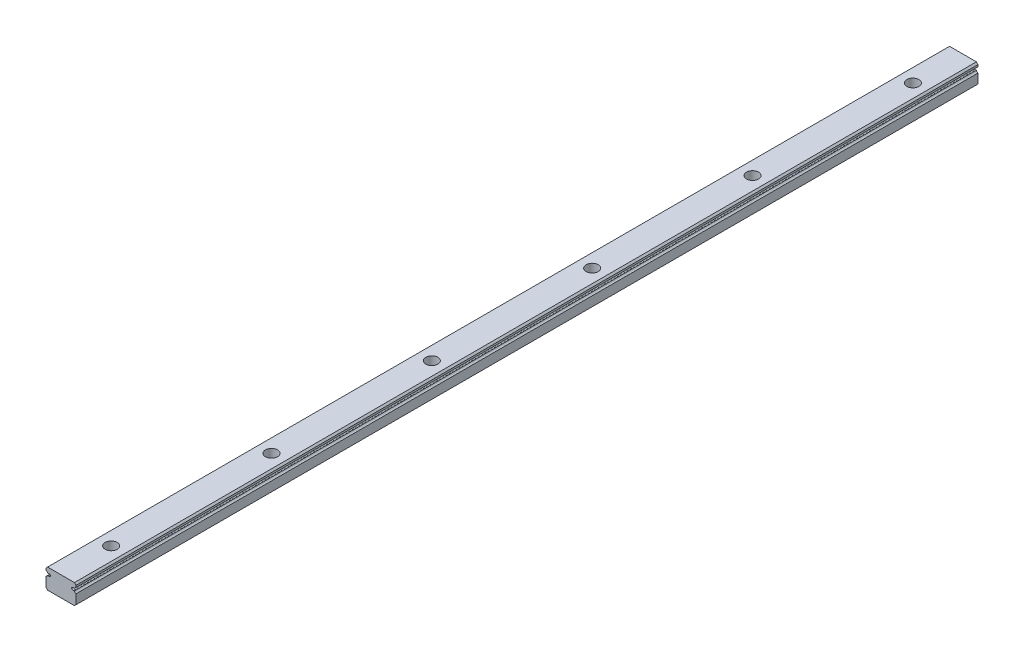
from build123d import *

# Parameters (mm, degrees)
BOSS_EXTRUDE1_DEPTH = 450
SKETCH2_R           = 3
CUT_EXTRUDE1_DEPTH  = 4.5
SKETCH3_R           = 1.75
CUT_EXTRUDE2_DEPTH  = 451.09610085
LPATTERN1_COUNT     = 6
LPATTERN1_PITCH     = 80


with BuildPart() as part:
    # Sketch1 → Boss-Extrude1 (new body)
    with BuildSketch(Plane.XY):
        with BuildLine():
            Line((6.624531067, 2.444), (6.139791576, 2.444))
            ThreePointArc((6.139791576, 2.444), (5.3, 1.894), (6.139791576, 1.344))
            Line((6.139791576, 1.344), (6.624531067, 1.344))
            ThreePointArc((6.624531067, 1.344), (6.975900024, 0.857004226), (7.5, 0.563841739))
            Line((7.5, 0.563841739), (7.5, -4.2))
            Line((7.5, -4.2), (6.7, -5))
            Line((6.7, -5), (-6.7, -5))
            Line((-6.7, -5), (-7.5, -4.2))
            Line((-7.5, -4.2), (-7.5, 0.563841739))
            ThreePointArc((-7.5, 0.563841739), (-6.975900024, 0.857004226), (-6.624531067, 1.344))
            Line((-6.624531067, 1.344), (-6.139791576, 1.344))
            ThreePointArc((-6.139791576, 1.344), (-5.3, 1.894), (-6.139791576, 2.444))
            Line((-6.139791576, 2.444), (-6.624531067, 2.444))
            ThreePointArc((-6.624531067, 2.444), (-6.975900024, 2.930995774), (-7.5, 3.224158261))
            Line((-7.5, 3.224158261), (-7.5, 4.2))
            Line((-7.5, 4.2), (-6.7, 5))
            Line((-6.7, 5), (6.7, 5))
            Line((6.7, 5), (7.5, 4.2))
            Line((7.5, 4.2), (7.5, 3.224158261))
            ThreePointArc((7.5, 3.224158261), (6.975900024, 2.930995774), (6.624531067, 2.444))
        make_face()
    extrude(amount=-BOSS_EXTRUDE1_DEPTH)

    # Sketch2 → Cut-Extrude1 (cut)
    with BuildSketch(Plane(origin=(0, 5, 0), x_dir=(1, 0, 0), z_dir=(0, 1, 0))):
        with Locations(Location((0, 25, 0), (0, 0, 270))):
            Circle(SKETCH2_R)
    cut_extrude1 = extrude(amount=-CUT_EXTRUDE1_DEPTH, mode=Mode.SUBTRACT)

    # Sketch3 → Cut-Extrude2 (cut, through all)
    with BuildSketch(Plane(origin=(0, 0.5, 0), x_dir=(1, 0, 0), z_dir=(0, 1, 0))):
        with Locations(Location((0, 25, 0), (0, 0, 270))):
            Circle(SKETCH3_R)
    cut_extrude2 = extrude(amount=-CUT_EXTRUDE2_DEPTH, mode=Mode.SUBTRACT)

    # LPattern1: Cut-Extrude1, Cut-Extrude2 ×6
    with Locations(*[(0, 0, -i * LPATTERN1_PITCH) for i in range(1, LPATTERN1_COUNT)]):
        add(cut_extrude1, mode=Mode.SUBTRACT)
        add(cut_extrude2, mode=Mode.SUBTRACT)


solid = part.part
